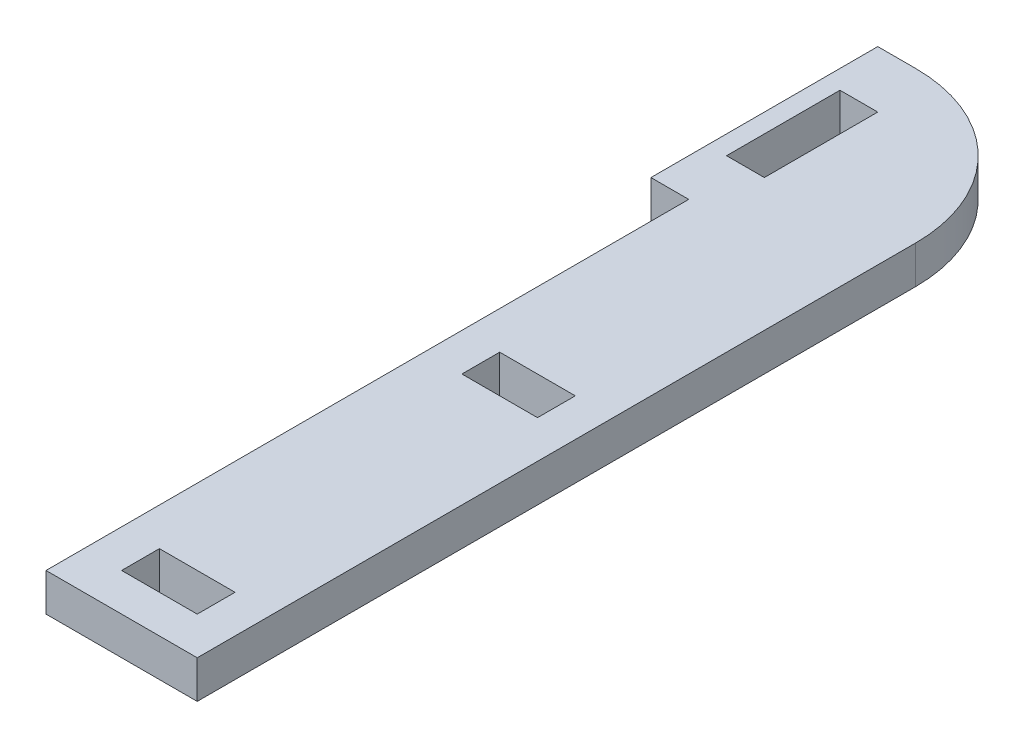
from build123d import *

# Parameters (mm, degrees)
SKETCH1_W           = 10
SKETCH1_H           = 5
SKETCH1_W_2         = 5
SKETCH1_H_2         = 15
BOSS_EXTRUDE1_DEPTH = 5


with BuildPart() as part:
    # Sketch1 → Boss-Extrude1 (new body)
    with BuildSketch(Plane(origin=(0, 0, 0), x_dir=(1, 0, 0), z_dir=(0, 1, 0))):
        with BuildLine():
            Line((-25.064538889, 20.027213551), (-5.064538889, 20.027213551))
            Line((-5.064538889, 20.027213551), (-5.064538889, 80.027213551))
            Line((-5.064538889, 80.027213551), (-5.064538889, 115.027213551))
            ThreePointArc((-5.064538889, 115.027213551), (-10.922403265, 129.169349175), (-25.064538889, 135.027213551))
            Line((-25.064538889, 135.027213551), (-30.064538889, 135.027213551))
            Line((-30.064538889, 135.027213551), (-30.064538889, 105.027213551))
            Line((-30.064538889, 105.027213551), (-25.064538889, 105.027213551))
            Line((-25.064538889, 105.027213551), (-25.064538889, 80.027213551))
            Line((-25.064538889, 80.027213551), (-25.064538889, 20.027213551))
        make_face()
        with Locations((-15.064538889, 27.527213551)):
            Rectangle(SKETCH1_W, SKETCH1_H, mode=Mode.SUBTRACT)
        with Locations((-15.064538889, 72.527213551)):
            Rectangle(SKETCH1_W, SKETCH1_H, mode=Mode.SUBTRACT)
        with Locations((-25.064538889, 120.027213551)):
            Rectangle(SKETCH1_W_2, SKETCH1_H_2, mode=Mode.SUBTRACT)
    extrude(amount=BOSS_EXTRUDE1_DEPTH)


solid = part.part
